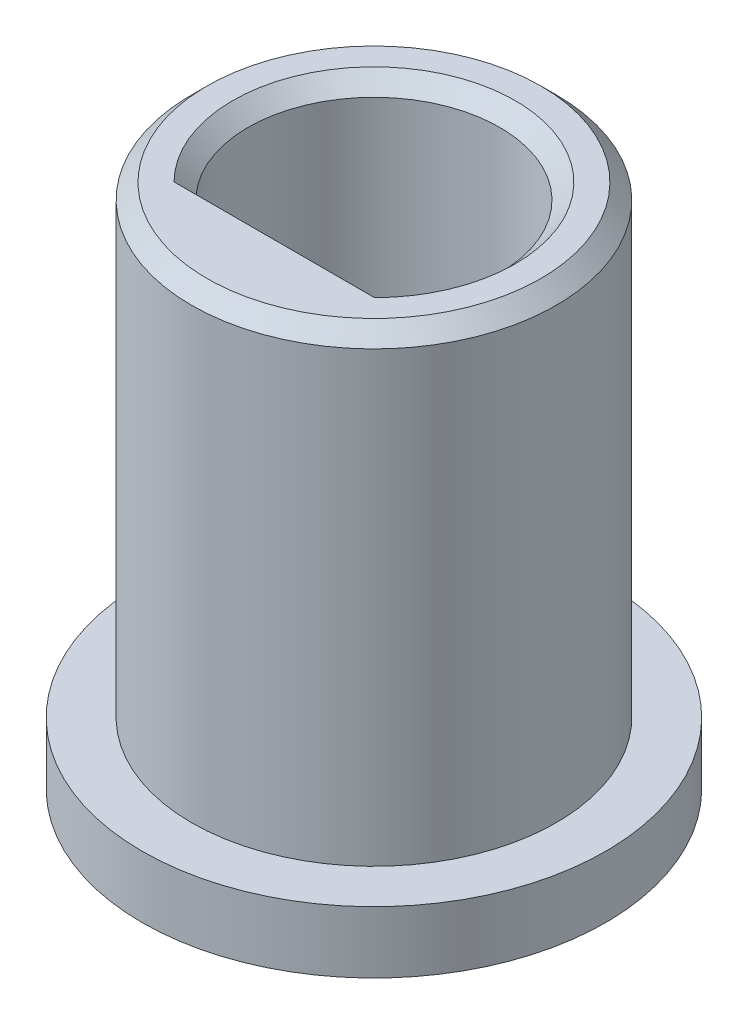
from build123d import *

# Parameters (mm, degrees)
SCHNITT_LINEAR_AUSTRAGEN1_DEPTH = 21.03746491
FASE1_SIZE                      = 0.5


with BuildPart() as part:
    # Skizze1 → Rotation1 (revolve)
    with BuildSketch(Plane.XY, mode=Mode.PRIVATE) as rotation1_sk:
        Polygon((0, 0), (7.5, 0), (7.5, 2), (5.9, 2), (5.9, 17), (0, 17), align=None)
    revolve(rotation1_sk.sketch.rotate(Axis((0, 0, 0), (0, -1, 0)), 90), axis=Axis((0, 0, 0), (0, -1, 0)))

    # Skizze2 → Schnitt-Linear austragen1 (cut, through all)
    with BuildSketch(Plane(origin=(0, 17, 0), x_dir=(1, 0, 0), z_dir=(0, 1, 0))):
        with BuildLine():
            Line((-3.029851482, -2.725), (3.029851482, -2.725))
            ThreePointArc((3.029851482, -2.725), (0, 4.075), (-3.029851482, -2.725))
        make_face()
    extrude(amount=-SCHNITT_LINEAR_AUSTRAGEN1_DEPTH, mode=Mode.SUBTRACT)

    # Fase1
    fase1_edges = [part.edges().sort_by_distance(p)[0] for p in [
        (0, 17, -4.075),
        (0, 17, 2.725),
        (0, 17, -5.9),
    ]]
    chamfer(fase1_edges, length=FASE1_SIZE)


solid = part.part
